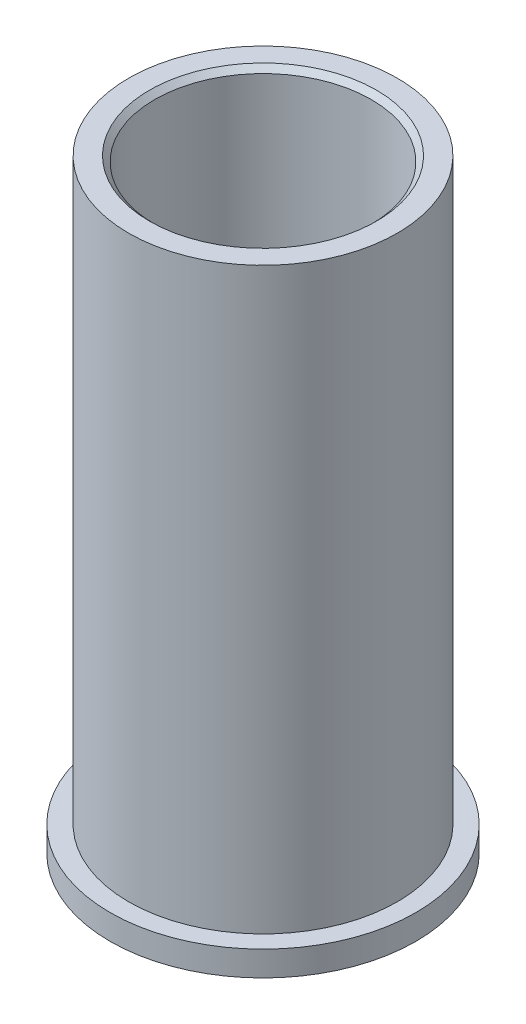
from build123d import *


with BuildPart() as part:
    # Sketch1 → Revolve1 (revolve)
    with BuildSketch(Plane(origin=(0, 0, 0), x_dir=(-1, 0, 0), z_dir=(0, 0, -1)), mode=Mode.PRIVATE) as revolve1_sk:
        Polygon((-14.4526, 0), (-10.7315, 0), (-10.2235, 0.508), (-10.2235, 56.5912), (-10.7315, 57.0992), (-12.69619, 57.0992), (-12.69619, 2.3622), (-14.4526, 2.3622), align=None)
    revolve(revolve1_sk.sketch.rotate(Axis((0, 0, 0), (0, 1, 0)), 270), axis=Axis((0, 0, 0), (0, 1, 0)))


solid = part.part
